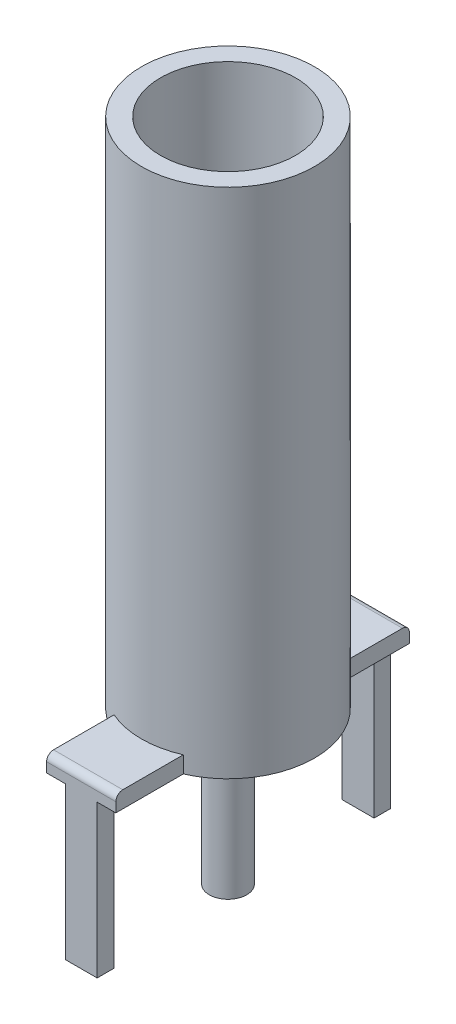
from build123d import *

# Parameters (mm, degrees)
SKETCH1_R           = 1.5875
BOSS_EXTRUDE1_DEPTH = 9.398
SKETCH2_R           = 0.3429
BOSS_EXTRUDE2_DEPTH = 2.794
SKETCH3_W           = 1.27
SKETCH3_H           = 5.3848
BOSS_EXTRUDE3_DEPTH = 0.3048
SKETCH4_W           = 0.5842
SKETCH4_H           = 0.3048
BOSS_EXTRUDE4_DEPTH = 2.794
FILLET1_R           = 0.127
SKETCH5_R           = 1.237083483
CUT_EXTRUDE1_DEPTH  = 7.874


with BuildPart() as part:
    # Sketch1 → Boss-Extrude1 (new body)
    with BuildSketch(Plane(origin=(0, 0, 0), x_dir=(1, 0, 0), z_dir=(0, 1, 0))):
        with Locations(Location((0, 0, 0), (0, 0, 270))):
            Circle(SKETCH1_R)
    extrude(amount=BOSS_EXTRUDE1_DEPTH)

    # Sketch2 → Boss-Extrude2 (add)
    with BuildSketch(Plane(origin=(0, 0, 0), x_dir=(-1, 0, 0), z_dir=(0, -1, 0))):
        with Locations(Location((0, 0, 0), (0, 0, 270))):
            Circle(SKETCH2_R)
    extrude(amount=BOSS_EXTRUDE2_DEPTH)

    # Sketch3 → Boss-Extrude3 (add)
    with BuildSketch(Plane(origin=(0, 0, 0), x_dir=(-1, 0, 0), z_dir=(0, -1, 0))):
        Rectangle(SKETCH3_W, SKETCH3_H)
    extrude(amount=-BOSS_EXTRUDE3_DEPTH)

    # Sketch4 → Boss-Extrude4 (add)
    with BuildSketch(Plane(origin=(0, 0, 0), x_dir=(-1, 0, 0), z_dir=(0, -1, 0))):
        with Locations((0, 2.54)):
            Rectangle(SKETCH4_W, SKETCH4_H)
        with Locations((0, -2.54)):
            Rectangle(SKETCH4_W, SKETCH4_H)
    extrude(amount=BOSS_EXTRUDE4_DEPTH)

    # Fillet1
    fillet1_edges = [part.edges().sort_by_distance(p)[0] for p in [
        (0, 0.3048, 2.6924),
        (0, 0.3048, -2.6924),
    ]]
    fillet(fillet1_edges, radius=FILLET1_R)

    # Sketch5 → Cut-Extrude1 (cut)
    with BuildSketch(Plane(origin=(0, 9.398, 0), x_dir=(1, 0, 0), z_dir=(0, 1, 0))):
        with Locations(Location((0, 0, 0), (0, 0, 270))):
            Circle(SKETCH5_R)
    extrude(amount=-CUT_EXTRUDE1_DEPTH, mode=Mode.SUBTRACT)


solid = part.part
